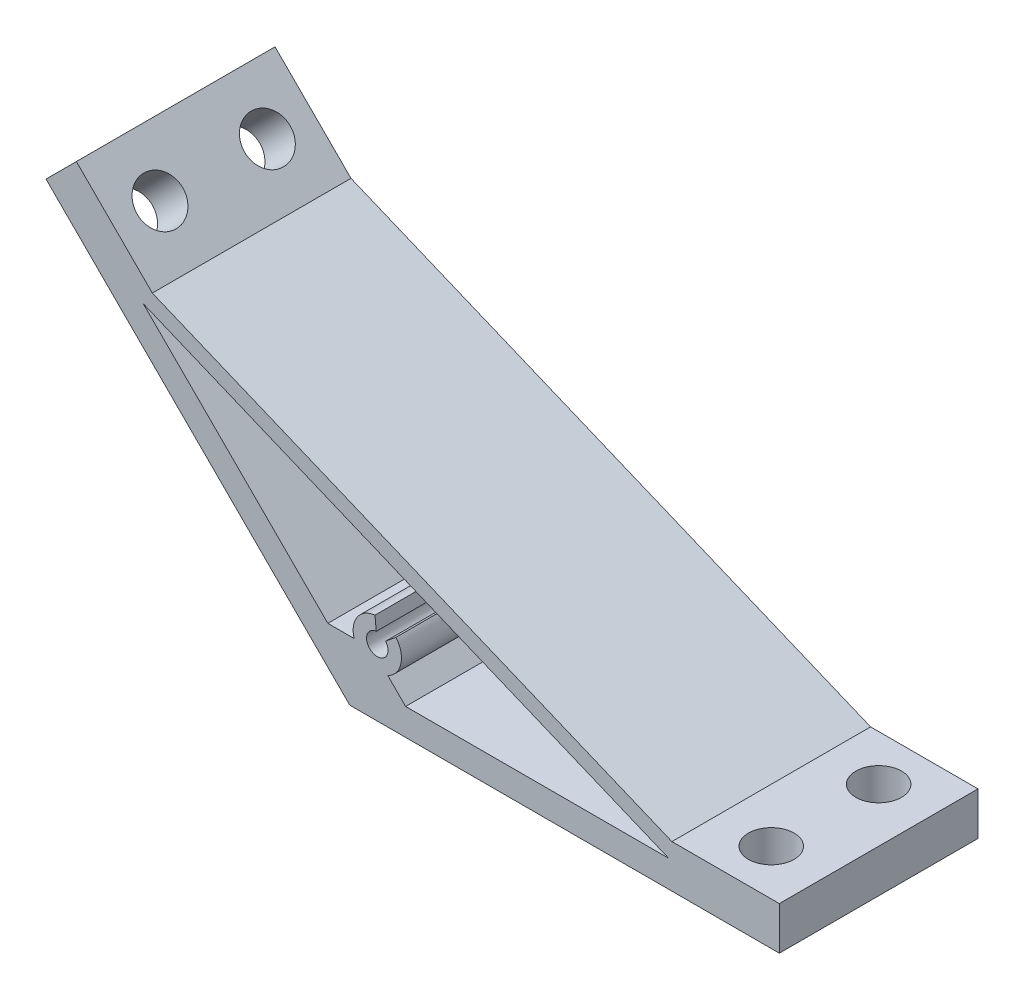
from build123d import *

# Parameters (mm, degrees)
EXTRUDE_1_DEPTH         = 18.5
HOLE_WIZARD_8_5_8_5_1_D = 8.5


with BuildPart() as part:
    # 草图1 → 凸台-拉伸1 (new, symmetric)
    with BuildSketch(Plane.XY):
        Polygon((6936.119122288, -1232.086390659), (6992.687664783, -1288.654933154), (7072.687664783, -1288.654933154), (7072.687664783, -1280.654933154), (7052.687664783, -1280.654933154), (6955.918112162, -1240.571672033), (6941.775976538, -1226.429536409), align=None)
        with BuildLine():
            Line((7009.090927681, -1283.654933154), (7003.090927681, -1283.654933154))
            Line((7003.090927681, -1283.654933154), (6999.760549745, -1280.324555218))
            ThreePointArc((6999.760549745, -1280.324555218), (7002.213755914, -1277.239517812), (7001.296666197, -1273.406161221))
            Line((7001.296666197, -1273.406161221), (6999.365595427, -1274.993916141))
            ThreePointArc((6999.365595427, -1274.993916141), (6997.055371947, -1278.111879141), (6997.626530039, -1274.273571671))
            Line((6997.626530039, -1274.273571671), (6997.383769074, -1271.785386165))
            ThreePointArc((6997.383769074, -1271.785386165), (6994.101203016, -1273.731324494), (6993.49338103, -1277.49861375))
            Line((6993.49338103, -1277.49861375), (6988.602413191, -1277.49861375))
            Line((6988.602413191, -1277.49861375), (6954.21874867, -1243.114949228))
            Line((6954.21874867, -1243.114949228), (7052.090927681, -1283.654933154))
            Line((7052.090927681, -1283.654933154), (7029.403393536, -1283.654933154))
            Line((7029.403393536, -1283.654933154), (7009.090927681, -1283.654933154))
        make_face(mode=Mode.SUBTRACT)
    extrude(amount=EXTRUDE_1_DEPTH, both=True)

    # Ø8.5 (8.5) 直径孔1 (through all)
    with Locations(Plane(origin=(2852.016365815, 2852.016365815, 0), x_dir=(0.7071067811865628, -0.7071067811865324, 0), z_dir=(-0.7071067811865324, -0.7071067811865628, 0))):
        with Locations((5785.79350833, -10), (5785.79350833, 10)):
            hole_wizard_8_5_8_5_1 = Hole(HOLE_WIZARD_8_5_8_5_1_D / 2)

    # 镜向1: Ø8.5 (8.5) 直径孔1 across plane
    add(hole_wizard_8_5_8_5_1.mirror(Plane(origin=(6424.240586557, -2661.0075789, 0), x_dir=(0, 0, 1), z_dir=(-0.9238795325112645, 0.3826834323651437, 0))), mode=Mode.SUBTRACT)


solid = part.part
